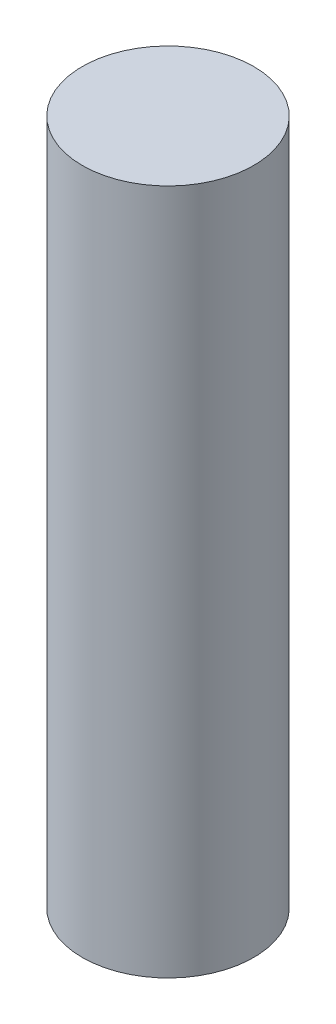
from build123d import *

# Parameters (mm, degrees)
ESQUISSE1_R        = 12.5
BOSS_EXTRU_1_DEPTH = 100


with BuildPart() as part:
    # Esquisse1 → Boss.-Extru.1 (new body)
    with BuildSketch(Plane(origin=(0, 0, 0), x_dir=(1, 0, 0), z_dir=(0, 1, 0))):
        with Locations(Location((0, 0, 0), (0, 0, 270))):
            Circle(ESQUISSE1_R)
    extrude(amount=BOSS_EXTRU_1_DEPTH)


solid = part.part
